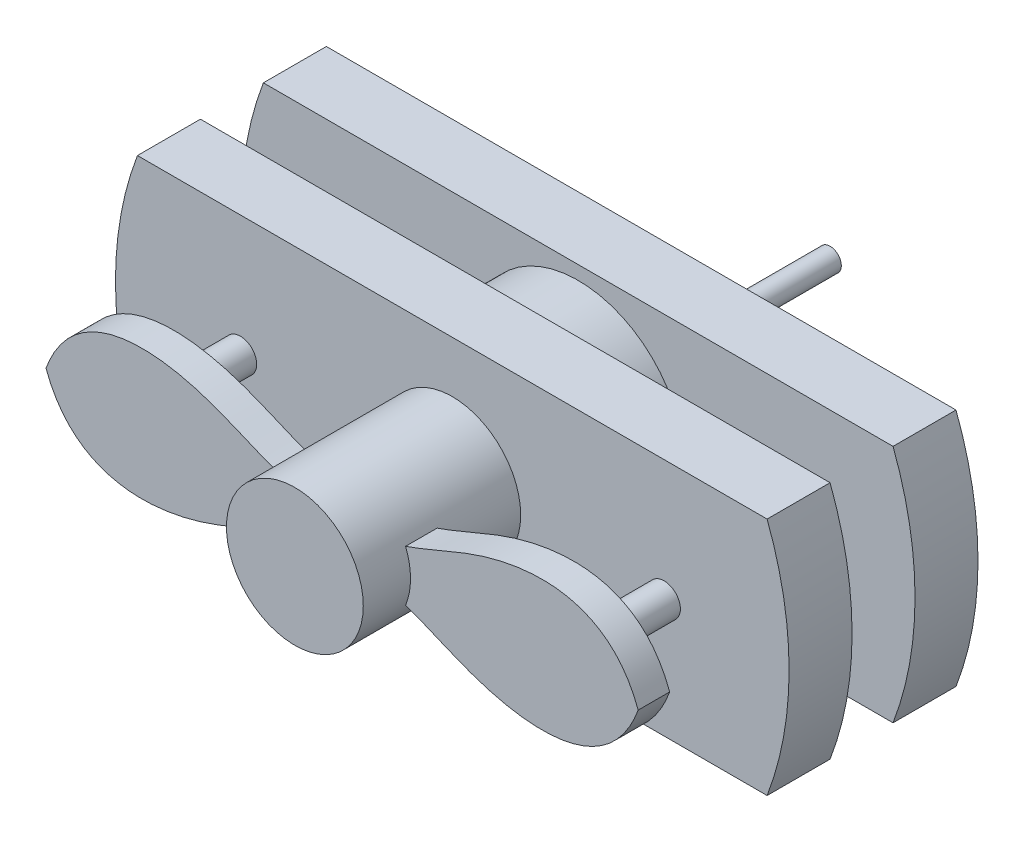
from build123d import *

# Parameters (mm, degrees)
BOSS_EXTRUDE1_DEPTH = 2.54
SKETCH2_R           = 4.277185328
BOSS_EXTRUDE2_DEPTH = 2.54
BOSS_EXTRUDE3_START = 2.54
BOSS_EXTRUDE3_DEPTH = 2.54
BOSS_EXTRUDE4_START = 3.175
BOSS_EXTRUDE4_DEPTH = 1.27
BOSS_EXTRUDE5_START = -9.525
SKETCH6_R           = 0.655755768
BOSS_EXTRUDE5_DEPTH = 8.255
SKETCH7_R           = 2.759618061
BOSS_EXTRUDE6_DEPTH = 6.35
SKETCH8_R           = 0.453273613
BOSS_EXTRUDE7_DEPTH = 7.62


with BuildPart() as part:
    # Sketch1 → Boss-Extrude1 (new body)
    with BuildSketch(Plane.XY):
        with BuildLine():
            Line((0, 0), (25.4, 0))
            ThreePointArc((25.4, 0), (26.287266684, 4.829473672), (25.4, 9.658947345))
            Line((25.4, 9.658947345), (0, 9.658947345))
            ThreePointArc((0, 9.658947345), (-0.887266684, 4.829473672), (0, 0))
        make_face()
    extrude(amount=BOSS_EXTRUDE1_DEPTH)

    # Sketch2 → Boss-Extrude2 (add)
    with BuildSketch(Plane.XY.offset(2.54)):
        with Locations((12.7, 4.829473672)):
            Circle(SKETCH2_R)
    extrude(amount=BOSS_EXTRUDE2_DEPTH)

    # Sketch4 → Boss-Extrude3 (add)
    with BuildSketch(Plane.XY.offset(2.54).offset(BOSS_EXTRUDE3_START)):
        with BuildLine():
            Line((25.4, 0), (0, 0))
            ThreePointArc((0, 0), (-0.887266684, 4.829473672), (0, 9.658947345))
            Line((0, 9.658947345), (25.4, 9.658947345))
            ThreePointArc((25.4, 9.658947345), (26.287266684, 4.829473672), (25.4, 0))
        make_face()
    extrude(amount=BOSS_EXTRUDE3_DEPTH)



with BuildPart() as body_2:
    # Sketch5 → Boss-Extrude4 (new body)
    with BuildSketch(Plane.XY.offset(7.62).offset(BOSS_EXTRUDE4_START)):
        with BuildLine():
            add(Edge.make_bspline(
                [(12.7, 4.20147434), (14.810733294, 4.318694194), (18.338650019, 1.879191252), (23.539856959, 1.828704507), (24.644301026, 4.829473672)],
                knots=[0, 0, 0, 0, 0.434443821, 1, 1, 1, 1], degree=3))
            add(Edge.make_bspline(
                [(12.7, 5.457473005), (14.810733294, 5.340253151), (18.338650019, 7.779756093), (23.539856959, 7.830242837), (24.644301026, 4.829473672)],
                knots=[0, 0, 0, 0, 0.434443821, 1, 1, 1, 1], degree=3))
            add(Edge.make_bspline(
                [(12.7, 5.457473005), (10.589266706, 5.340253151), (7.061349981, 7.779756093), (1.860143041, 7.830242837), (0.755698974, 4.829473672)],
                knots=[0, 0, 0, 0, 0.434443821, 1, 1, 1, 1], degree=3))
            add(Edge.make_bspline(
                [(12.7, 4.20147434), (10.589266706, 4.318694194), (7.061349981, 1.879191252), (1.860143041, 1.828704507), (0.755698974, 4.829473672)],
                knots=[0, 0, 0, 0, 0.434443821, 1, 1, 1, 1], degree=3))
        make_face()
    extrude(amount=BOSS_EXTRUDE4_DEPTH)


with BuildPart() as part_1:
    add(part.part)

    add(body_2.part)  # Boss-Extrude5 merges body 2
    # Sketch6 → Boss-Extrude5 (add)
    with BuildSketch(Plane.XY.offset(12.065).offset(BOSS_EXTRUDE5_START)):
        with Locations((21.245716404, 4.76790511)):
            Circle(SKETCH6_R)
        with Locations((4.154283596, 4.76790511)):
            Circle(SKETCH6_R)
    extrude(amount=BOSS_EXTRUDE5_DEPTH)

    # Sketch7 → Boss-Extrude6 (add)
    with BuildSketch(Plane.XY.offset(7.62)):
        with Locations((12.7, 4.829473672)):
            Circle(SKETCH7_R)
    extrude(amount=BOSS_EXTRUDE6_DEPTH)

    # Sketch8 → Boss-Extrude7 (add)
    with BuildSketch(Plane(origin=(0, 0, 0), x_dir=(-1, 0, 0), z_dir=(0, 0, -1))):
        with Locations(Location((-12.7, 4.767836587, 0), (0, 0, 180))):
            Circle(SKETCH8_R)
    extrude(amount=BOSS_EXTRUDE7_DEPTH)


solid = part_1.part
